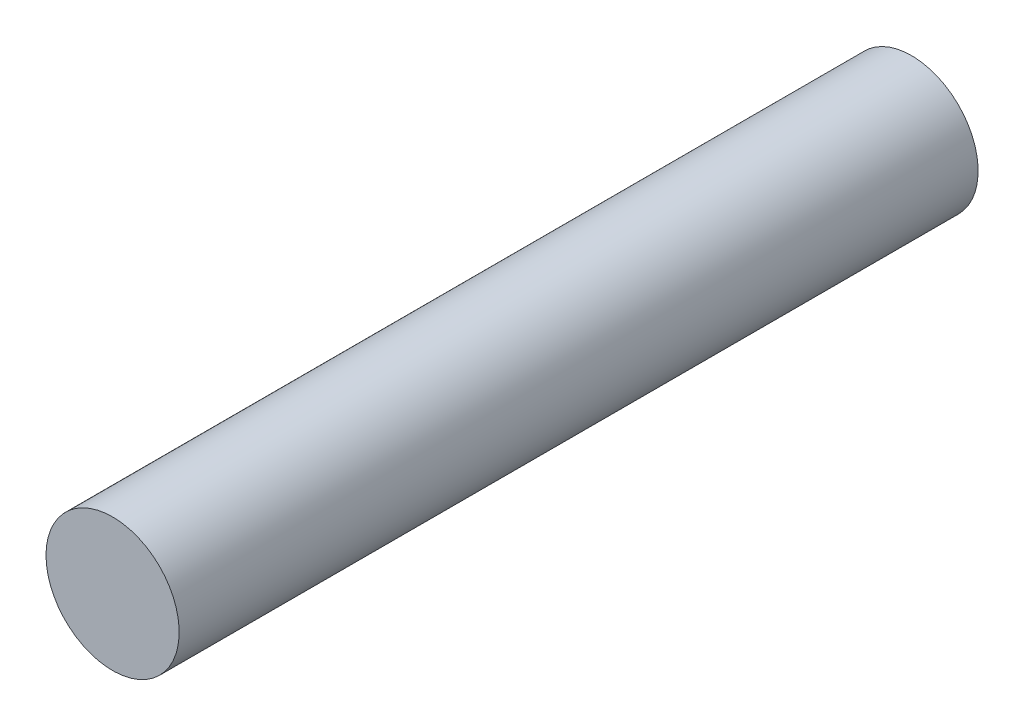
from build123d import *

# Parameters (mm, degrees)
SKETCH1_R           = 12.7
BOSS_EXTRUDE1_DEPTH = 152.4


with BuildPart() as part:
    # Sketch1 → Boss-Extrude1 (new body)
    with BuildSketch(Plane.XY):
        with Locations(Location((0, 0, 0), (0, 0, 180))):
            Circle(SKETCH1_R)
    extrude(amount=BOSS_EXTRUDE1_DEPTH)


solid = part.part
